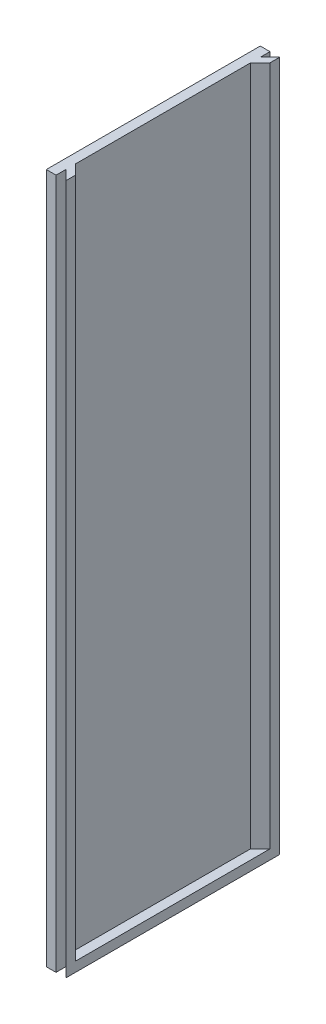
from build123d import *

# Parameters (mm, degrees)
EXTRUDE_1_DEPTH = 71
EXTRUDE_2_DEPTH = 1


with BuildPart() as part:
    # 草图2 → 凸台-拉伸1 (new body)
    with BuildSketch(Plane(origin=(0, 0, 0), x_dir=(1, 0, 0), z_dir=(0, 1, 0))):
        Polygon((-1, 11), (0, 11), (0, 10), (1, 11), (1, 10), (0, 9), (0, -9), (1, -10), (1, -11), (0, -10), (0, -11), (-1, -11), align=None)
    extrude(amount=EXTRUDE_1_DEPTH)

    # 草图3 → 凸台-拉伸2 (add)
    with BuildSketch(Plane.XZ):
        Polygon((1, 10), (1, -10), (0, -9), (0, 9), align=None)
    extrude(amount=-EXTRUDE_2_DEPTH)


solid = part.part
